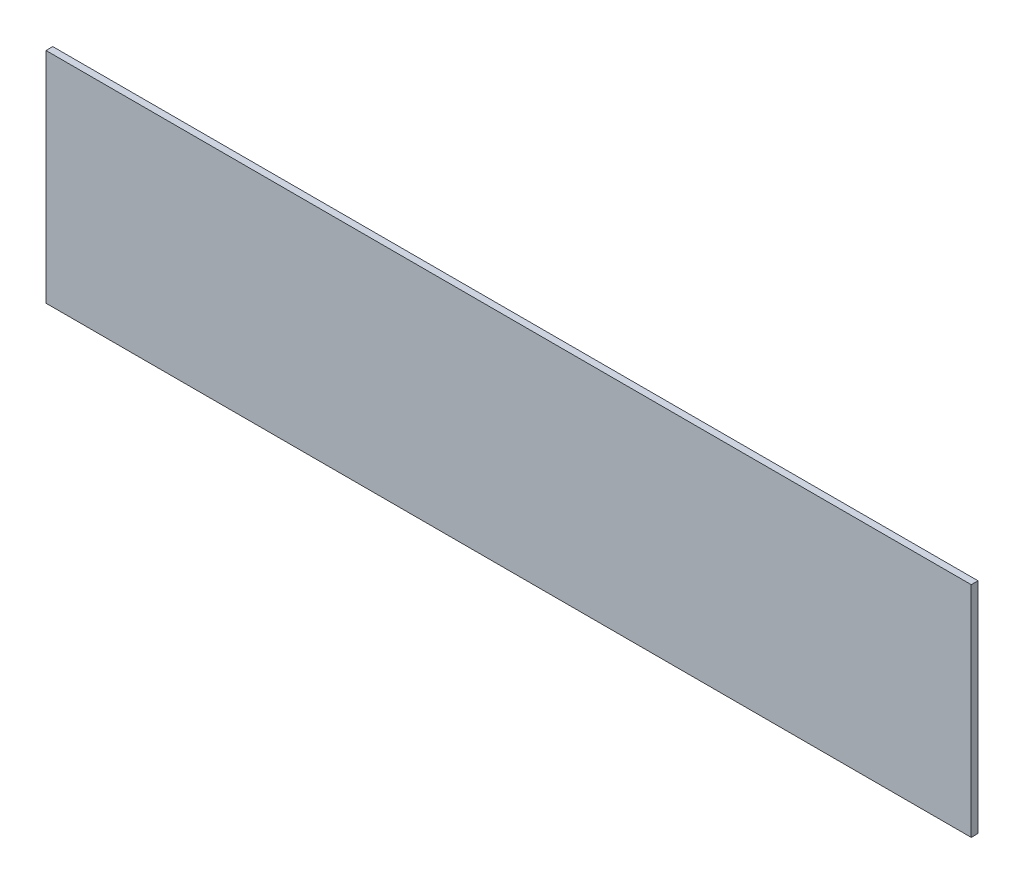
from build123d import *

# Parameters (mm, degrees)
CROQUIS1_W              = 410
CROQUIS1_H              = 97
SALIENTE_EXTRUIR1_DEPTH = 3


with BuildPart() as part:
    # Croquis1 → Saliente-Extruir1 (new body)
    with BuildSketch(Plane.XY):
        Rectangle(CROQUIS1_W, CROQUIS1_H)
    extrude(amount=SALIENTE_EXTRUIR1_DEPTH)


solid = part.part
